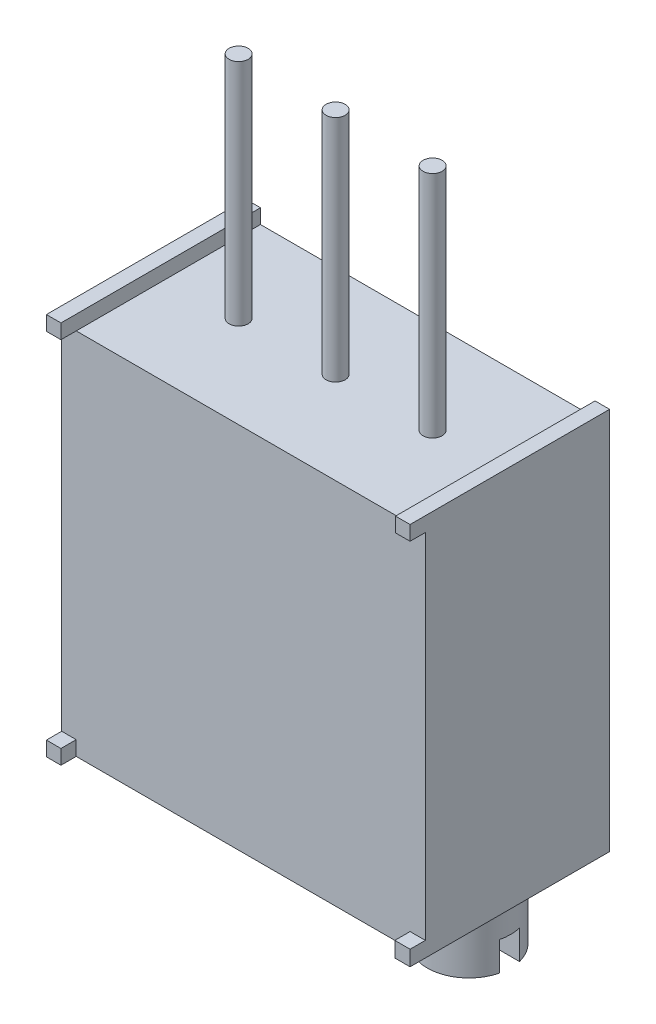
from build123d import *

# Parameters (mm, degrees)
CROQUIS1_R                = 0.25
SALIENTE_EXTRUIR1_DEPTH   = 6
SALIENTE_EXTRUIR1_2_DEPTH = 6
SALIENTE_EXTRUIR1_3_DEPTH = 6
CROQUIS2_W                = 9.525
CROQUIS2_H                = 4.826
SALIENTE_EXTRUIR2_DEPTH   = 9.652
CROQUIS3_W                = 0.381
CROQUIS3_H                = 4.826
SALIENTE_EXTRUIR3_DEPTH   = 0.381
CROQUIS4_W                = 0.381
CROQUIS4_H                = 0.381
CROQUIS4_W_2              = 0.4
CROQUIS4_H_2              = 0.4
SALIENTE_EXTRUIR4_DEPTH   = 0.4
CROQUIS5_R                = 1.0922
SALIENTE_EXTRUIR5_DEPTH   = 1.524
CROQUIS6_W                = 2.512066748
CROQUIS6_H                = 0.526501072
CORTAR_EXTRUIR1_DEPTH     = 0.762


with BuildPart() as part:
    # Croquis1 → Saliente-Extruir1 (new body)
    with BuildSketch(Plane(origin=(0, 0, 0), x_dir=(1, 0, 0), z_dir=(0, 1, 0))):
        with Locations(Location((0, 0, 0), (0, 0, 270))):
            Circle(CROQUIS1_R)
    extrude(amount=SALIENTE_EXTRUIR1_DEPTH)



with BuildPart() as body_2:
    # Croquis1 → Saliente-Extruir1 2 (new body)
    with BuildSketch(Plane(origin=(0, 0, 0), x_dir=(1, 0, 0), z_dir=(0, 1, 0))):
        with Locations(Location((2.54, 0, 0), (0, 0, 270))):
            Circle(CROQUIS1_R)
    extrude(amount=SALIENTE_EXTRUIR1_2_DEPTH)


with BuildPart() as body_3:
    # Croquis1 → Saliente-Extruir1 3 (new body)
    with BuildSketch(Plane(origin=(0, 0, 0), x_dir=(1, 0, 0), z_dir=(0, 1, 0))):
        with Locations(Location((5.08, 0, 0), (0, 0, 270))):
            Circle(CROQUIS1_R)
    extrude(amount=SALIENTE_EXTRUIR1_3_DEPTH)


with BuildPart() as part_1:
    add(part.part)

    add(body_2.part)  # Saliente-Extruir2 merges body 2

    add(body_3.part)  # Saliente-Extruir2 merges body 3
    # Croquis2 → Saliente-Extruir2 (add)
    with BuildSketch(Plane(origin=(0, 0, 0), x_dir=(1, 0, 0), z_dir=(0, 1, 0))):
        with Locations((2.54, 0)):
            Rectangle(CROQUIS2_W, CROQUIS2_H)
    extrude(amount=-SALIENTE_EXTRUIR2_DEPTH)

    # Croquis3 → Saliente-Extruir3 (add)
    with BuildSketch(Plane(origin=(0, 0, 0), x_dir=(1, 0, 0), z_dir=(0, 1, 0))):
        with Locations((-2.032, 0)):
            Rectangle(CROQUIS3_W, CROQUIS3_H)
        with Locations((7.112, 0)):
            Rectangle(CROQUIS3_W, CROQUIS3_H)
    extrude(amount=SALIENTE_EXTRUIR3_DEPTH)

    # Croquis4 → Saliente-Extruir4 (add)
    with BuildSketch(Plane.XY.offset(2.413)):
        with Locations((-2.032, 0.1905)):
            Rectangle(CROQUIS4_W, CROQUIS4_H)
        with Locations((7.112, 0.1905)):
            Rectangle(CROQUIS4_W, CROQUIS4_H)
        with Locations((-2.032, -9.4615)):
            Rectangle(CROQUIS4_W, CROQUIS4_H)
        with Locations((7.1025, -9.452)):
            Rectangle(CROQUIS4_W_2, CROQUIS4_H_2)
    extrude(amount=SALIENTE_EXTRUIR4_DEPTH)

    # Croquis5 → Saliente-Extruir5 (add)
    with BuildSketch(Plane.XZ.offset(9.652)):
        with Locations(Location((6.0325, 0, 0), (0, 0, 90))):
            Circle(CROQUIS5_R)
    extrude(amount=SALIENTE_EXTRUIR5_DEPTH)

    # Croquis6 → Cortar-Extruir1 (cut)
    with BuildSketch(Plane.XZ.offset(11.176)):
        with Locations((6.0325, 0)):
            Rectangle(CROQUIS6_W, CROQUIS6_H)
    extrude(amount=-CORTAR_EXTRUIR1_DEPTH, mode=Mode.SUBTRACT)


solid = part_1.part
